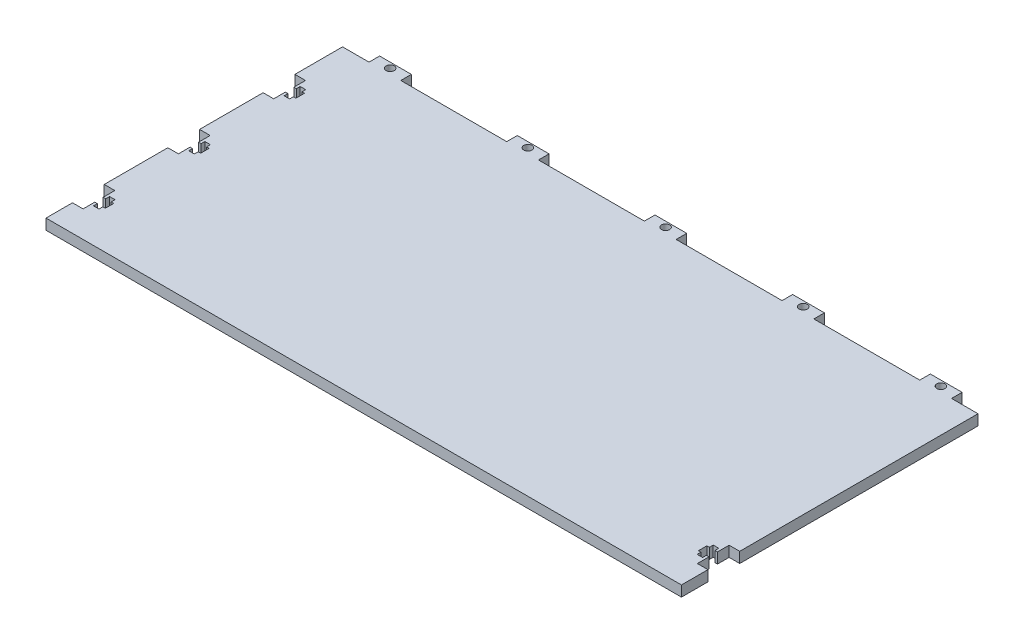
from build123d import *

# Parameters (mm, degrees)
SKETCH1_W                    = 381
SKETCH1_H                    = 177.8
BOSS_EXTRUDE1_DEPTH          = 6.35
SKETCH2_W                    = 19.05
SKETCH2_H                    = 6.35
BOSS_EXTRUDE2_DEPTH          = 6.35
F_10_0_1935_DIAMETER_HOLE1_D = 4.9149
LPATTERN1_COUNT              = 5
LPATTERN1_PITCH              = 82.55
CUT_EXTRUDE2_DEPTH           = 424.216900655
LPATTERN4_COUNT              = 3
LPATTERN4_PITCH              = 57.15


with BuildPart() as part:
    # Sketch1 → Boss-Extrude1 (new body)
    with BuildSketch(Plane(origin=(0, 0, 0), x_dir=(1, 0, 0), z_dir=(0, 1, 0))):
        with Locations((190.5, 88.9)):
            Rectangle(SKETCH1_W, SKETCH1_H)
    extrude(amount=BOSS_EXTRUDE1_DEPTH)

    # Sketch2 → Boss-Extrude2 (add)
    with BuildSketch(Plane(origin=(0, 6.35, 0), x_dir=(1, 0, 0), z_dir=(0, 1, 0))):
        with Locations((25.4, 180.975)):
            Rectangle(SKETCH2_W, SKETCH2_H)
    boss_extrude2 = extrude(amount=-BOSS_EXTRUDE2_DEPTH)

    # #10 (0.1935) Diameter Hole1 (through all)
    with Locations(Plane(origin=(0, 6.35, 0), x_dir=(1, 0, 0), z_dir=(0, 1, 0))):
        with Locations((25.4, 180.975)):
            f_10_0_1935_diameter_hole1 = Hole(F_10_0_1935_DIAMETER_HOLE1_D / 2)

    # LPattern1: Boss-Extrude2, #10 (0.1935) Diameter Hole1 ×5
    with Locations(*[(i * LPATTERN1_PITCH, 0, 0) for i in range(1, LPATTERN1_COUNT)]):
        add(boss_extrude2)
        add(f_10_0_1935_diameter_hole1, mode=Mode.SUBTRACT)

    # Sketch7 → Cut-Extrude2 (cut, through all)
    with BuildSketch(Plane(origin=(0, 6.35, 0), x_dir=(1, 0, 0), z_dir=(0, 1, 0))):
        Polygon((0, 34.925), (0, 15.875), (6.35, 15.875), (6.35, 22.86), (7.874, 22.86), (7.874, 20.574), (11.176, 20.574), (11.176, 22.86), (12.7, 22.86), (12.7, 27.94), (11.176, 27.94), (11.176, 30.226), (7.874, 30.226), (7.874, 27.94), (6.35, 27.94), (6.35, 34.925), align=None)
    cut_extrude2 = extrude(amount=-CUT_EXTRUDE2_DEPTH, mode=Mode.SUBTRACT)

    # Mirror2: Cut-Extrude2 across plane
    add(cut_extrude2.mirror(Plane.ZY.offset(-190.5)), mode=Mode.SUBTRACT)

    # LPattern4: Cut-Extrude2 ×3
    with Locations(*[(0, 0, -i * LPATTERN4_PITCH) for i in range(1, LPATTERN4_COUNT)]):
        add(cut_extrude2, mode=Mode.SUBTRACT)


solid = part.part
